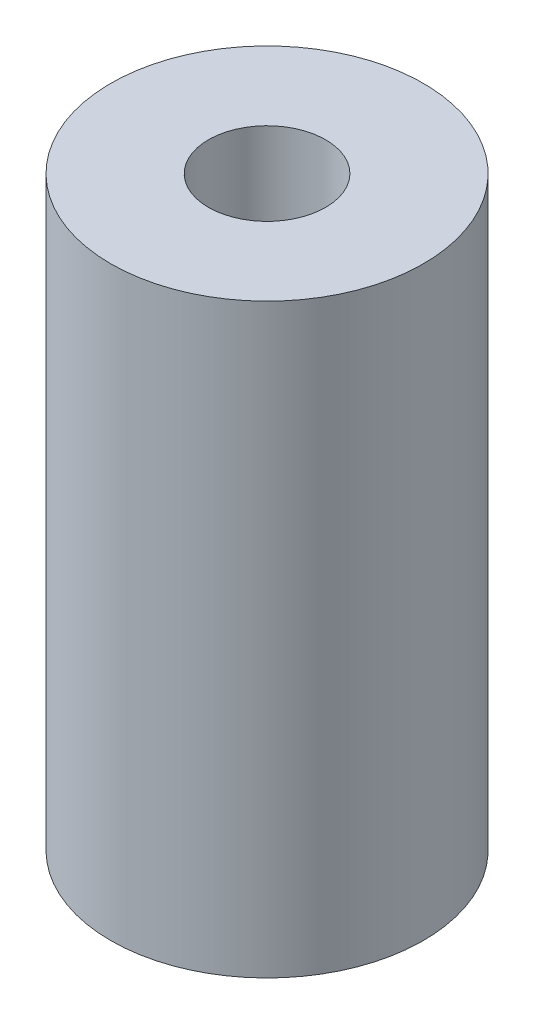
from build123d import *

# Parameters (mm, degrees)
SKETCH2_R           = 4
SKETCH2_R_2         = 1.5
BOSS_EXTRUDE2_DEPTH = 15


with BuildPart() as part:
    # Sketch2 → Boss-Extrude2 (new body)
    with BuildSketch(Plane(origin=(0, 0, 0), x_dir=(1, 0, 0), z_dir=(0, 1, 0))):
        with Locations(Location((0, 0, 0), (0, 0, 270))):
            Circle(SKETCH2_R)
        with Locations(Location((0, 0, 0), (0, 0, 270))):
            Circle(SKETCH2_R_2, mode=Mode.SUBTRACT)
    extrude(amount=BOSS_EXTRUDE2_DEPTH)


solid = part.part
